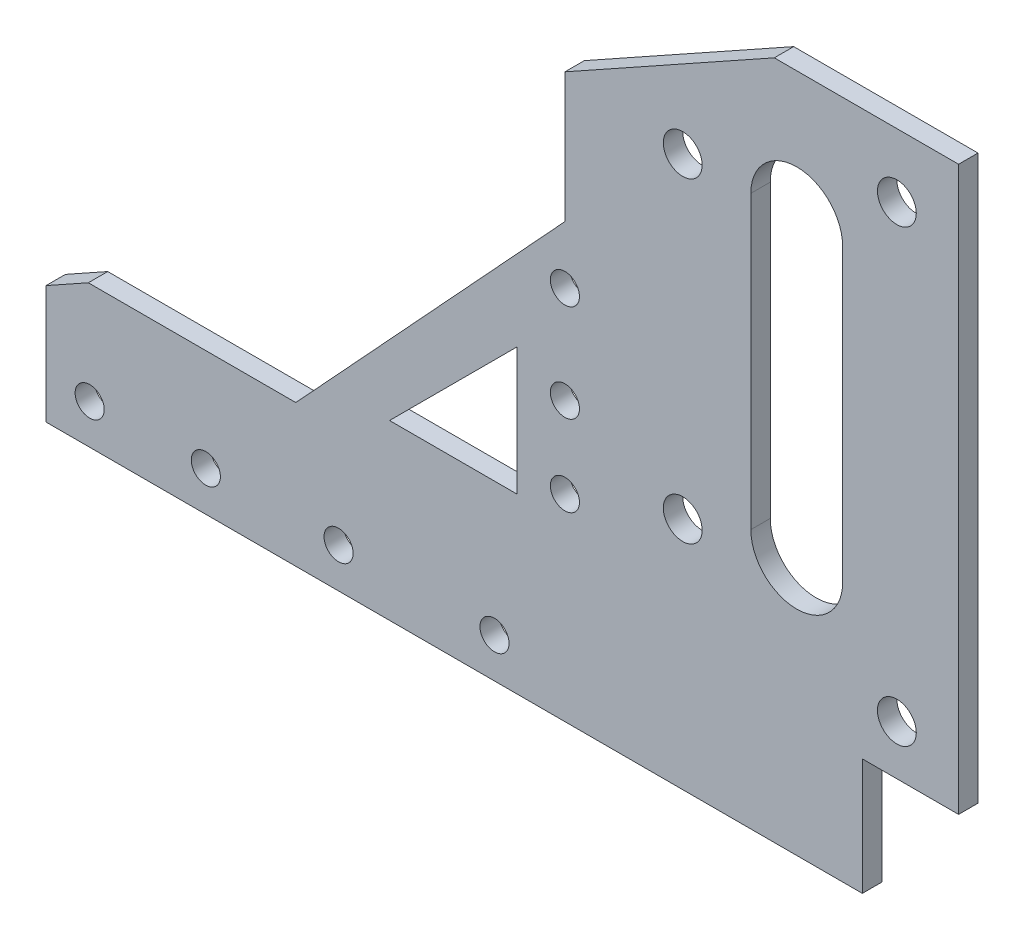
from build123d import *

# Parameters (mm, degrees)
SKETCH1_R           = 7.5
SKETCH1_R_2         = 10
BOSS_EXTRUDE1_DEPTH = 10


with BuildPart() as part:
    # Sketch1 → Boss-Extrude1 (new body)
    with BuildSketch(Plane.XY):
        Polygon((-98.05511991, -17.859318996), (322.382476836, -17.859318996), (322.382476836, 42.140681004), (371.94488009, 42.140681004), (371.94488009, 332.140681004), (277.025034275, 332.140681004), (169.187054595, 271.975052979), (169.187054595, 205.170044114), (30.5872252, 55.170044114), (-76.268588622, 55.170044114), (-98.05511991, 43.014768752), align=None)
        with Locations((-15.752224544, 2.649813362)):
            Circle(SKETCH1_R, mode=Mode.SUBTRACT)
        with Locations((-75.556801399, 2.649813362)):
            Circle(SKETCH1_R, mode=Mode.SUBTRACT)
        with Locations((52.636779721, 2.649813362)):
            Circle(SKETCH1_R, mode=Mode.SUBTRACT)
        with Locations((132.925934878, 2.649813362)):
            Circle(SKETCH1_R, mode=Mode.SUBTRACT)
        with Locations((169.187054595, 83.663978495)):
            Circle(SKETCH1_R, mode=Mode.SUBTRACT)
        with Locations((169.187054595, 125.357526882)):
            Circle(SKETCH1_R, mode=Mode.SUBTRACT)
        with Locations((169.187054595, 175.474014337)):
            Circle(SKETCH1_R, mode=Mode.SUBTRACT)
        with Locations((229.870255563, 265.671146953)):
            Circle(SKETCH1_R_2, mode=Mode.SUBTRACT)
        with Locations((229.870255563, 102.825256229)):
            Circle(SKETCH1_R_2, mode=Mode.SUBTRACT)
        with Locations((340.159565259, 299.323240315)):
            Circle(SKETCH1_R_2, mode=Mode.SUBTRACT)
        with Locations((340.159565259, 67.667528684)):
            Circle(SKETCH1_R_2, mode=Mode.SUBTRACT)
        with BuildLine():
            Line((312.226028305, 265.671146953), (312.226028305, 115.671146953))
            ThreePointArc((312.226028305, 115.671146953), (288.591642629, 92.036761277), (264.957256952, 115.671146953))
            Line((264.957256952, 115.671146953), (264.957256952, 265.671146953))
            ThreePointArc((264.957256952, 265.671146953), (288.591642629, 289.30553263), (312.226028305, 265.671146953))
        make_face(mode=Mode.SUBTRACT)
        Polygon((78.874891909, 71.306483913), (144.620819019, 137.052411023), (144.620819019, 71.306483913), align=None, mode=Mode.SUBTRACT)
    extrude(amount=BOSS_EXTRUDE1_DEPTH)


solid = part.part
